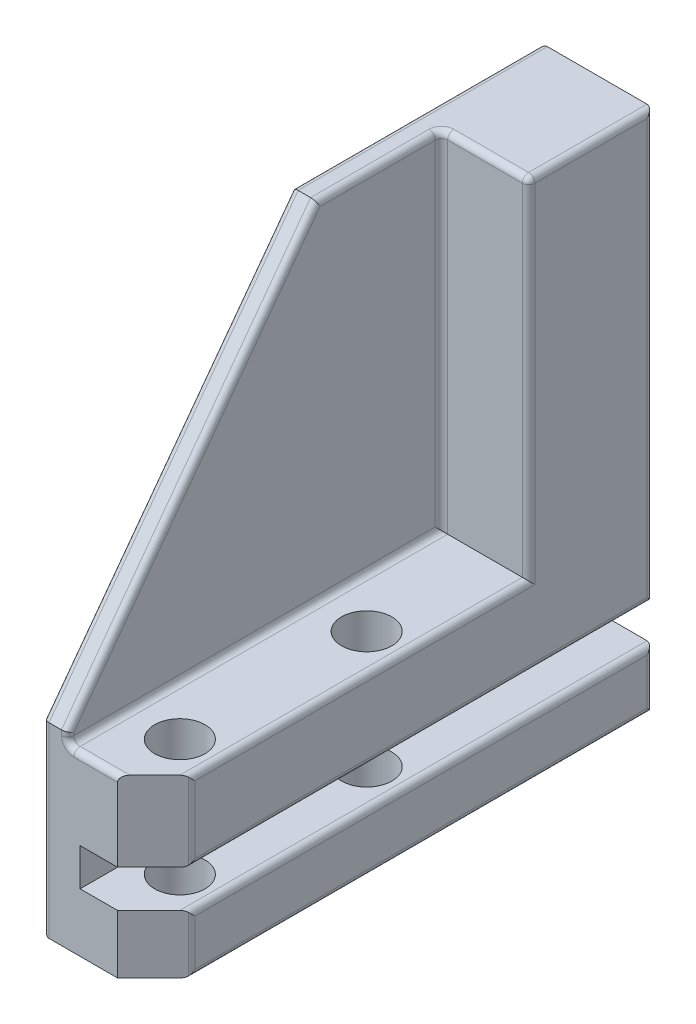
from build123d import *

# Parameters (mm, degrees)
SKETCH1_W           = 9
SKETCH1_H           = 42
SKETCH1_R           = 2.02
SKETCH1_R_2         = 1.5875
BOSS_EXTRUDE1_DEPTH = 40
SKETCH1_3_R         = 2.02
SKETCH1_3_R_2       = 1.5875
CUT_EXTRUDE1_DEPTH  = 8
SKETCH2_W           = 40
SKETCH2_H           = 3
CUT_EXTRUDE2_DEPTH  = 6
CUT_EXTRUDE3_DEPTH  = 9
CUT_EXTRUDE6_DEPTH  = 7
SKETCH6_R           = 2.0193
CUT_EXTRUDE5_DEPTH  = 20
FILLET2_R           = 0.5
CHAMFER4_SIZE       = 3
FILLET3_R           = 0.5


with BuildPart() as part:
    # Sketch1 → Boss-Extrude1 (new body)
    # profile 1 of 4: a face of its own
    with BuildSketch(Plane.XY):
        with Locations((4.5, 21)):
            Rectangle(SKETCH1_W, SKETCH1_H)
        with Locations((4.5, 16)):
            Circle(SKETCH1_R, mode=Mode.SUBTRACT)
        with Locations((4.5, 28)):
            Circle(SKETCH1_R, mode=Mode.SUBTRACT)
    # profile 2 of 4: a face of its own
    with BuildSketch(Plane.XY):
        with Locations((4.5, 28)):
            Circle(SKETCH1_R)
    # profile 3 of 4: a face of its own
    with BuildSketch(Plane.XY):
        with Locations((4.5, 16)):
            Circle(SKETCH1_R)
    # profile 4 of 4: a face of its own
    with BuildSketch(Plane.XY):
        with Locations((4.5, 35)):
            Circle(SKETCH1_R_2)
    extrude(amount=BOSS_EXTRUDE1_DEPTH)

    # Sketch1<3> → Cut-Extrude1 (cut)
    with BuildSketch(Plane.XY):
        with Locations((4.5, 28)):
            Circle(SKETCH1_3_R)
        with Locations((4.5, 35)):
            Circle(SKETCH1_3_R_2)
        with Locations((4.5, 16)):
            Circle(SKETCH1_3_R)
    extrude(amount=CUT_EXTRUDE1_DEPTH, mode=Mode.SUBTRACT)

    # Sketch2 → Cut-Extrude2 (cut)
    with BuildSketch(Plane(origin=(9, 0, 0), x_dir=(0, 0, -1), z_dir=(1, 0, 0))):
        with Locations((-20, 6.2)):
            Rectangle(SKETCH2_W, SKETCH2_H)
    extrude(amount=-CUT_EXTRUDE2_DEPTH, mode=Mode.SUBTRACT)

    # Sketch3 → Cut-Extrude3 (cut)
    with BuildSketch(Plane(origin=(9, 0, 0), x_dir=(0, 0, -1), z_dir=(1, 0, 0))):
        Polygon((-20, 42), (-40, 15), (-48.379363257, 51.913157268), align=None)
    extrude(amount=-CUT_EXTRUDE3_DEPTH, mode=Mode.SUBTRACT)

    # Sketch5 → Cut-Extrude6 (cut)
    with BuildSketch(Plane.ZY.offset(-9)):
        Polygon((20, 42), (10, 42), (10, 14.1), (40, 14.1), (40, 15), align=None)
    extrude(amount=CUT_EXTRUDE6_DEPTH, mode=Mode.SUBTRACT)

    # Sketch6 → Cut-Extrude5 (cut)
    with BuildSketch(Plane.XZ):
        with Locations(Location((6, 35, 0), (0, 0, 90))):
            Circle(SKETCH6_R)
        with Locations(Location((6, 20, 0), (0, 0, 90))):
            Circle(SKETCH6_R)
    extrude(amount=-CUT_EXTRUDE5_DEPTH, mode=Mode.SUBTRACT)

    # Fillet2
    fillet2_edges = [part.edges().sort_by_distance(p)[0] for p in [
        (0, 0, 20),
        (0, 7.5, 40),
        (0, 42, 10),
        (0, 28.5, 30),
        (0, 21, 0),
    ]]
    fillet(fillet2_edges, radius=FILLET2_R)

    # Chamfer4
    chamfer4_edges = [part.edges().sort_by_distance(p)[0] for p in [
        (9, 2.35, 40),
        (9, 10.9, 40),
    ]]
    chamfer(chamfer4_edges, length=CHAMFER4_SIZE)

    # Fillet3
    fillet3_edges = [part.edges().sort_by_distance(p)[0] for p in [
        (9, 4.7, 18.5),
        (9, 0, 18.5),
        (9, 2.35, 37),
        (9, 10.9, 37),
        (9, 24.85, 0),
        (9, 7.7, 18.5),
        (9, 42, 5),
        (9, 14.1, 23.5),
        (2, 14.55, 40),
        (4, 14.1, 40),
        (2, 28.5, 30),
        (2, 42, 15),
        (9, 28.05, 10),
        (5.5, 42, 10),
        (2, 14.1, 25),
        (2, 28.05, 10),
        (9, 2.35, 0),
    ]]
    fillet(fillet3_edges, radius=FILLET3_R)


solid = part.part
